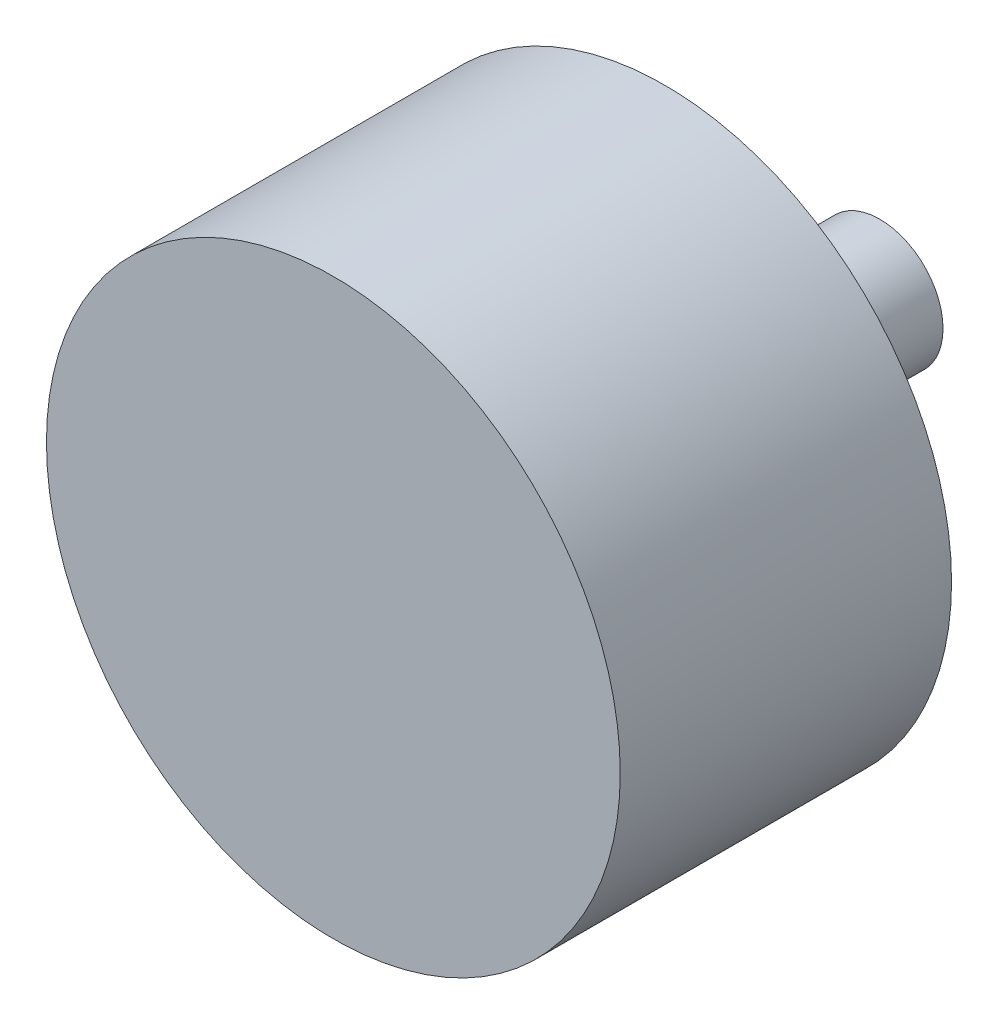
from build123d import *


with BuildPart() as part:
    # Sketch1 → Revolve1 (revolve)
    with BuildSketch(Plane(origin=(0, 0, 0), x_dir=(0, 0, -1), z_dir=(1, 0, 0)), mode=Mode.PRIVATE) as revolve1_sk:
        Polygon((0, 0), (0, 21.336), (24.638, 21.336), (24.638, 5.461), (30.48, 5.461), (30.48, 4.699), (40.64, 4.699), (40.64, 0), align=None)
    revolve(revolve1_sk.sketch.rotate(Axis((0, 0, 0), (0, 0, -1)), 90), axis=Axis((0, 0, 0), (0, 0, -1)))


solid = part.part
